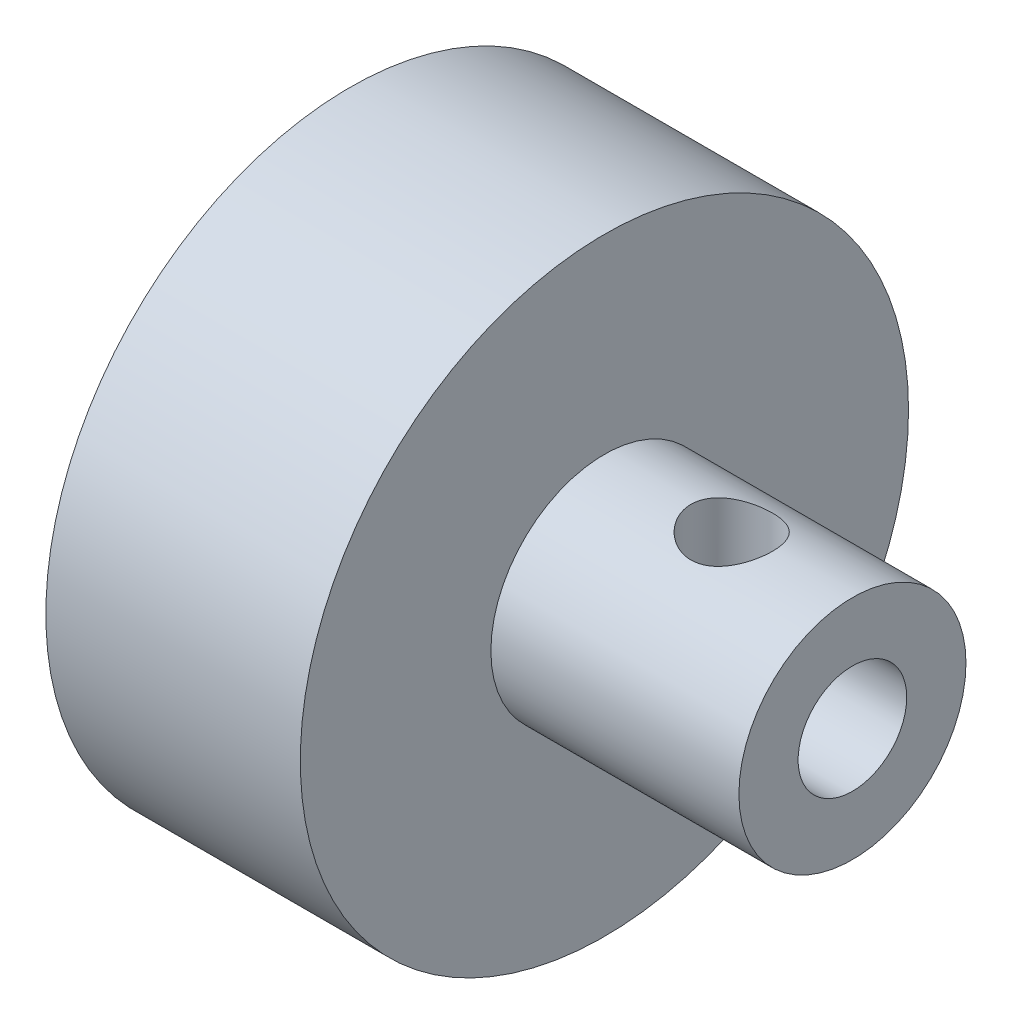
from build123d import *

# Parameters (mm, degrees)
CUT_EXTRUDE1_DEPTH      = 20.334926531
CUT_EXTRUDE1_DEPTH_BACK = 20.334926531
SKETCH2_R               = 1.190625


with BuildPart() as part:
    # Sketch1 → Revolve1 (revolve)
    with BuildSketch(Plane.XY):
        Polygon((0, 1.5875), (0, 3.319160609), (-7.250077802, 3.319160609), (-7.250077802, 8.89), (-14.689288069, 8.89), (-14.689288069, 1.5875), align=None)
    revolve(axis=Axis((0, 0, 0), (-1, 0, 0)))

    # Sketch2 → Cut-Extrude1 (cut, two sides: drawn at the far end of the back side and taken through both)
    with BuildSketch(Plane(origin=(0, 0, 0), x_dir=(1, 0, 0), z_dir=(0, 1, 0)).offset(-CUT_EXTRUDE1_DEPTH_BACK)):
        with Locations((-3.529556327, 0)):
            Circle(SKETCH2_R)
    extrude(amount=CUT_EXTRUDE1_DEPTH + CUT_EXTRUDE1_DEPTH_BACK, mode=Mode.SUBTRACT)


solid = part.part
